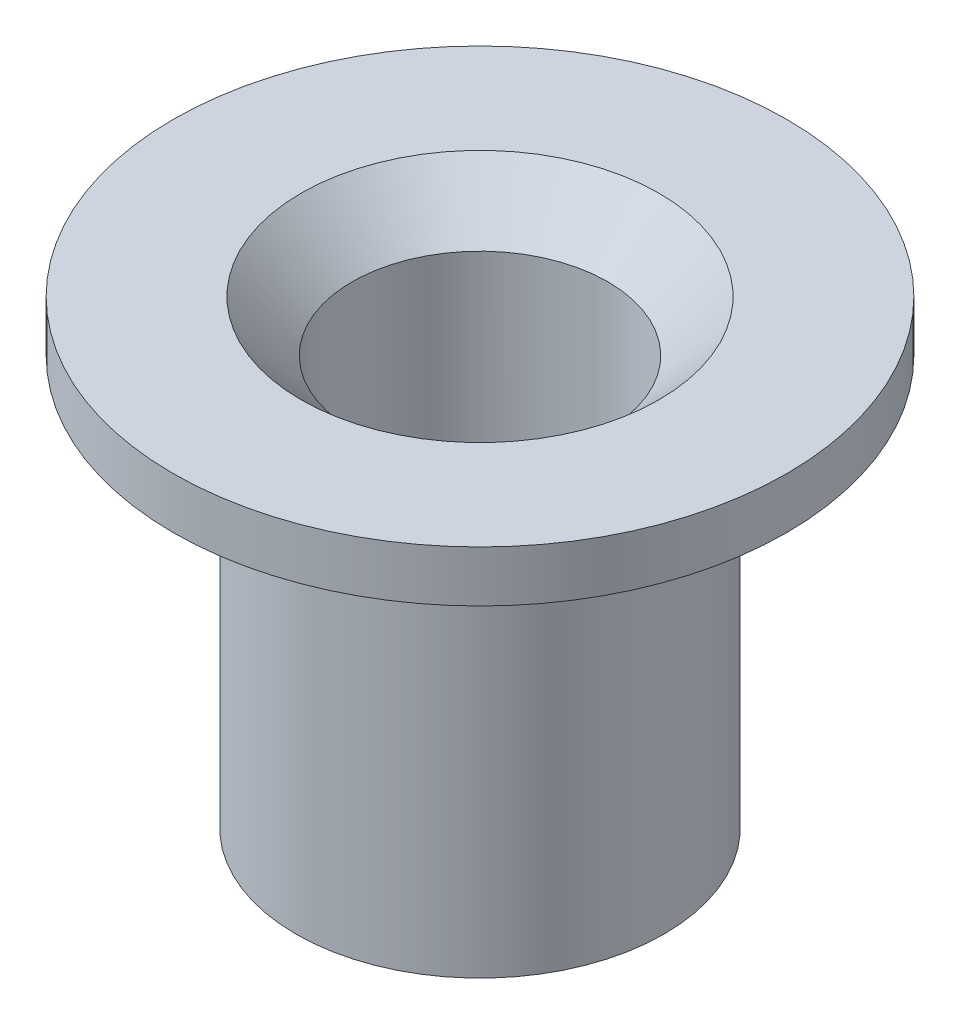
from build123d import *

# Parameters (mm, degrees)
CHAMFER1_SIZE = 1
CHAMFER2_SIZE = 1


with BuildPart() as part:
    # Sketch1 → Revolve1 (revolve)
    with BuildSketch(Plane(origin=(0, 0, 0), x_dir=(0, 0, -1), z_dir=(1, 0, 0))):
        Polygon((2.5, 9), (2.5, 0), (3.6, 0), (3.6, 8), (6, 8), (6, 9), align=None)
    revolve(axis=Axis((0, 0, 0), (0, 1, 0)))

    # Chamfer1
    chamfer1_edges = [part.edges().sort_by_distance(p)[0] for p in [
        (0, 8, 3.6),
    ]]
    chamfer(chamfer1_edges, length=CHAMFER1_SIZE)

    # Chamfer2
    chamfer2_edges = [part.edges().sort_by_distance(p)[0] for p in [
        (0, 9, 2.5),
    ]]
    chamfer(chamfer2_edges, length=CHAMFER2_SIZE)


solid = part.part
